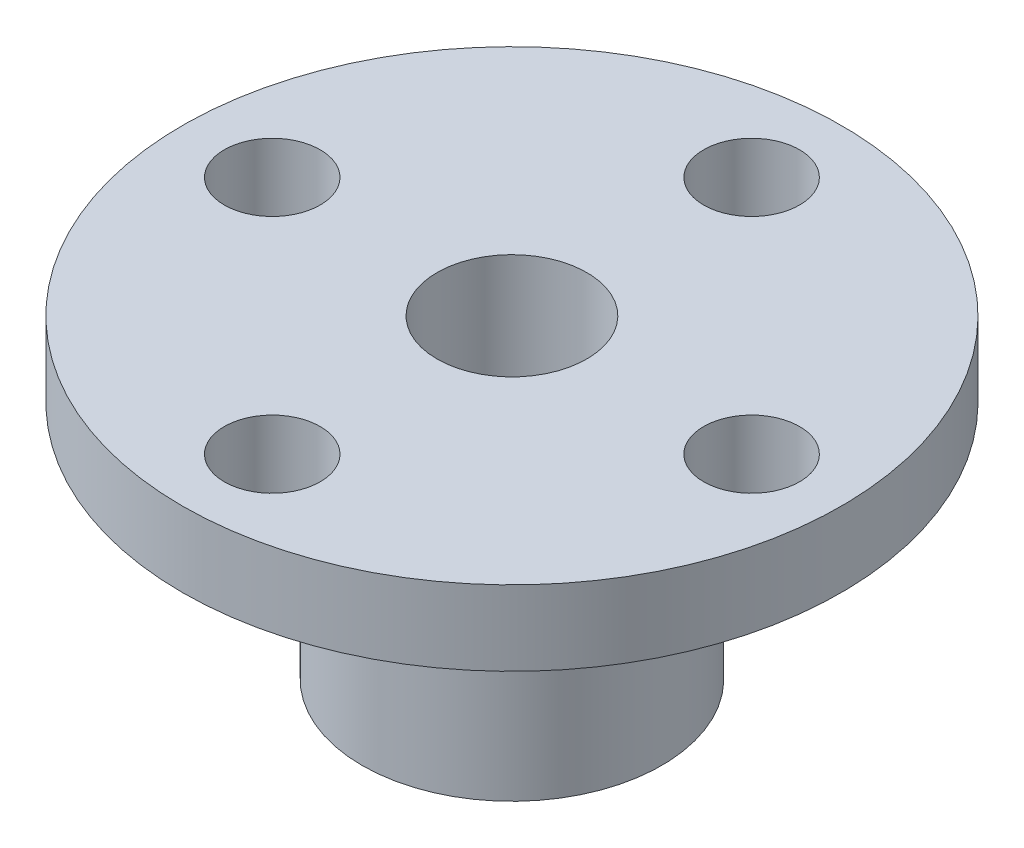
from build123d import *

# Parameters (mm, degrees)
SKETCH_1_R      = 5
SKETCH_1_R_2    = 2.5
EXTRUDE_1_DEPTH = 8
SKETCH_2_R      = 11
SKETCH_2_R_2    = 2.5
SKETCH_2_R_3    = 1.6
EXTRUDE_2_DEPTH = 2.5


with BuildPart() as part:
    # 草图1 → 凸台-拉伸1 (new body)
    with BuildSketch(Plane(origin=(0, 0, 0), x_dir=(1, 0, 0), z_dir=(0, 1, 0))):
        with Locations(Location((0, 0, 0), (0, 0, 270))):
            Circle(SKETCH_1_R)
        with Locations(Location((0, 0, 0), (0, 0, 270))):
            Circle(SKETCH_1_R_2, mode=Mode.SUBTRACT)
    extrude(amount=EXTRUDE_1_DEPTH)

    # 草图2 → 凸台-拉伸2 (add)
    with BuildSketch(Plane(origin=(0, 8, 0), x_dir=(-1, 0, 0), z_dir=(0, 1, 0))):
        with Locations(Location((0, 0, 0), (0, 0, 90))):
            Circle(SKETCH_2_R)
        with Locations(Location((0, 0, 0), (0, 0, 90))):
            Circle(SKETCH_2_R_2, mode=Mode.SUBTRACT)
        with Locations(Location((-8, 0, 0), (0, 0, 90))):
            Circle(SKETCH_2_R_3, mode=Mode.SUBTRACT)
        with Locations(Location((0, 8, 0), (0, 0, 90))):
            Circle(SKETCH_2_R_3, mode=Mode.SUBTRACT)
        with Locations(Location((8, 0, 0), (0, 0, 90))):
            Circle(SKETCH_2_R_3, mode=Mode.SUBTRACT)
        with Locations(Location((0, -8, 0), (0, 0, 90))):
            Circle(SKETCH_2_R_3, mode=Mode.SUBTRACT)
    extrude(amount=EXTRUDE_2_DEPTH)


solid = part.part
